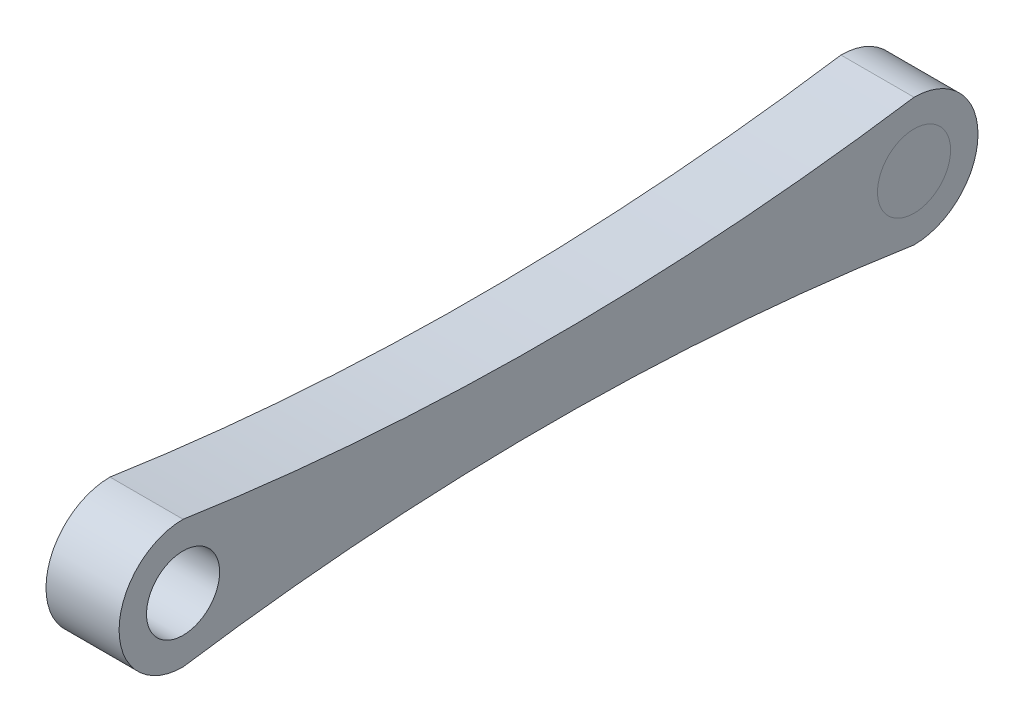
from build123d import *

# Parameters (mm, degrees)
SKETCH1_R           = 1
BOSS_EXTRUDE1_DEPTH = 2
SKETCH2_R           = 1
BOSS_EXTRUDE2_DEPTH = 2


with BuildPart() as part:
    # Sketch1 → Boss-Extrude1 (new body)
    with BuildSketch(Plane(origin=(0, 0, 0), x_dir=(0, 0, -1), z_dir=(1, 0, 0))):
        with BuildLine():
            ThreePointArc((-10, 1.75), (-11.75, 0), (-10, -1.75))
            ThreePointArc((-10, -1.75), (0, -1), (10, -1.75))
            ThreePointArc((10, -1.75), (11.75, 0), (10, 1.75))
            ThreePointArc((10, 1.75), (0, 1), (-10, 1.75))
        make_face()
        with Locations((-10, 0)):
            Circle(SKETCH1_R, mode=Mode.SUBTRACT)
        with Locations((10, 0)):
            Circle(SKETCH1_R, mode=Mode.SUBTRACT)
    extrude(amount=BOSS_EXTRUDE1_DEPTH)


with BuildPart() as body_2:
    # Sketch2 → Boss-Extrude2 (new body)
    with BuildSketch(Plane(origin=(2, 0, 0), x_dir=(0, 0, -1), z_dir=(1, 0, 0))):
        with Locations((10, 0)):
            Circle(SKETCH2_R)
    extrude(amount=-BOSS_EXTRUDE2_DEPTH)


solid = Compound([part.part, body_2.part])
